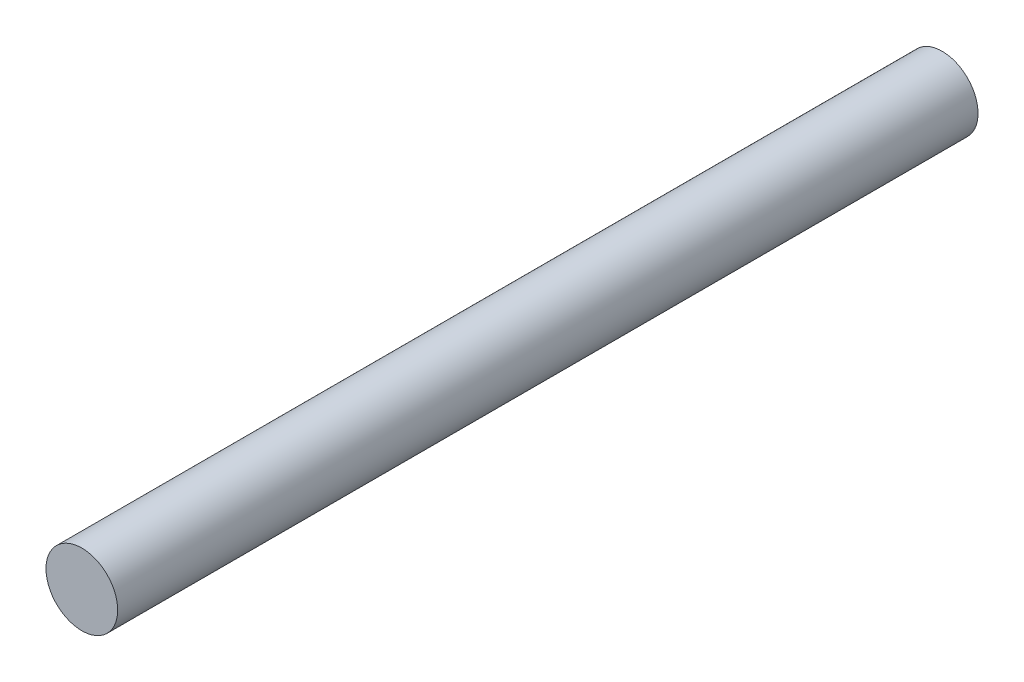
from build123d import *

# Parameters (mm, degrees)
SKETCH1_R           = 3.175
BOSS_EXTRUDE1_DEPTH = 76.2


with BuildPart() as part:
    # Sketch1 → Boss-Extrude1 (new body)
    with BuildSketch(Plane.XY):
        with Locations(Location((0, 0, 0), (0, 0, 180))):
            Circle(SKETCH1_R)
    extrude(amount=BOSS_EXTRUDE1_DEPTH)


solid = part.part
